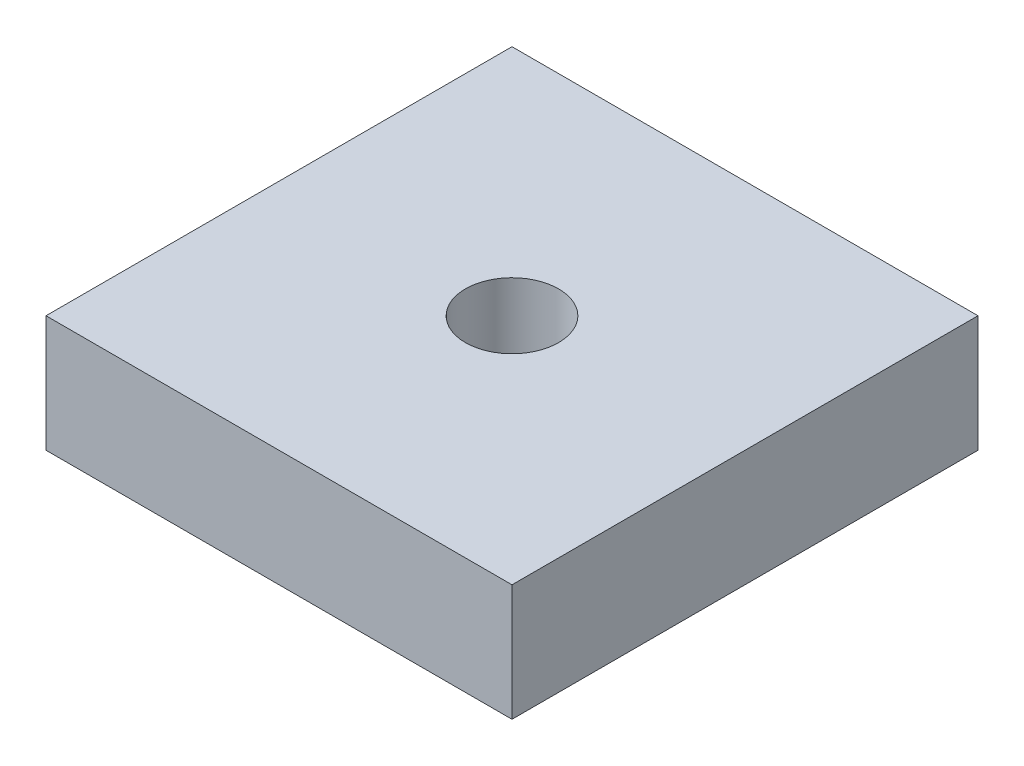
from build123d import *

# Parameters (mm, degrees)
SKETCH1_W           = 20
SKETCH1_H           = 20
SKETCH1_R           = 2
BOSS_EXTRUDE1_DEPTH = 5


with BuildPart() as part:
    # Sketch1 → Boss-Extrude1 (new body)
    with BuildSketch(Plane(origin=(0, 0, 0), x_dir=(1, 0, 0), z_dir=(0, 1, 0))):
        Rectangle(SKETCH1_W, SKETCH1_H)
        with Locations(Location((0, 0, 0), (0, 0, 270))):
            Circle(SKETCH1_R, mode=Mode.SUBTRACT)
    extrude(amount=BOSS_EXTRUDE1_DEPTH)


solid = part.part
